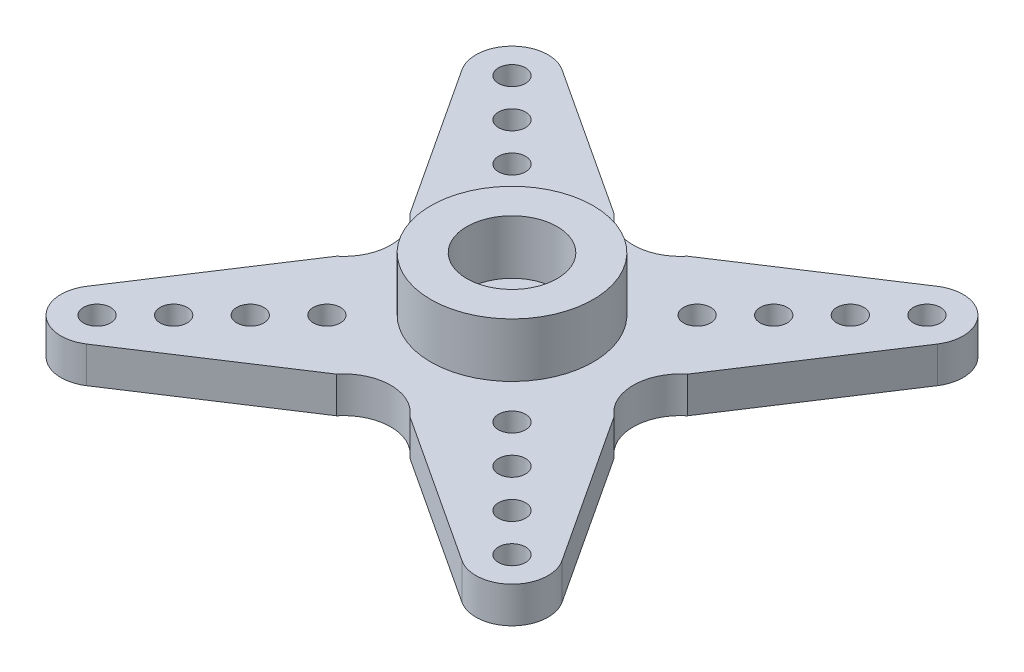
from build123d import *

# Parameters (mm, degrees)
BOSS_EXTRUDE1_DEPTH          = 2
SKETCH5_R                    = 4.5
SKETCH5_R_2                  = 2.5
BOSS_EXTRUDE2_DEPTH          = 3
SKETCH8_R                    = 1.5
CUT_EXTRUDE2_DEPTH           = 28.531284582
CUT_EXTRUDE3_REACH           = 29.531
SKETCH10_R                   = 0.75
LPATTERN1_COUNT              = 4
LPATTERN1_PITCH              = 3
CIRPATTERN1_COPY_1_REACH     = 29.531
CIRPATTERN1_COPY_1_SKETCH_R  = 0.75
CIRPATTERN1_COPY_2_REACH     = 29.531
CIRPATTERN1_COPY_2_SKETCH_R  = 0.75
CIRPATTERN1_COPY_3_REACH     = 29.531
CIRPATTERN1_COPY_3_SKETCH_R  = 0.75
CIRPATTERN1_COPY_4_REACH     = 29.531
CIRPATTERN1_COPY_4_SKETCH_R  = 0.75
CIRPATTERN1_COPY_5_REACH     = 29.531
CIRPATTERN1_COPY_5_SKETCH_R  = 0.75
CIRPATTERN1_COPY_6_REACH     = 29.531
CIRPATTERN1_COPY_6_SKETCH_R  = 0.75
CIRPATTERN1_COPY_7_REACH     = 29.531
CIRPATTERN1_COPY_7_SKETCH_R  = 0.75
CIRPATTERN1_COPY_8_REACH     = 29.531
CIRPATTERN1_COPY_8_SKETCH_R  = 0.75
CIRPATTERN1_COPY_9_REACH     = 29.531
CIRPATTERN1_COPY_9_SKETCH_R  = 0.75
CIRPATTERN1_COPY_10_REACH    = 29.531
CIRPATTERN1_COPY_10_SKETCH_R = 0.75
CIRPATTERN1_COPY_11_REACH    = 29.531
CIRPATTERN1_COPY_11_SKETCH_R = 0.75
CIRPATTERN1_COPY_12_REACH    = 29.531
CIRPATTERN1_COPY_12_SKETCH_R = 0.75
SKETCH9_R                    = 4.5
SKETCH9_R_2                  = 3.3
SKETCH9_R_3                  = 2.8
SKETCH9_R_4                  = 1.5
CUT_EXTRUDE4_DEPTH           = 1


with BuildPart() as part:
    # Sketch1 → Boss-Extrude1 (new body)
    with BuildSketch(Plane(origin=(0, 0, 0), x_dir=(1, 0, 0), z_dir=(0, 1, 0))):
        with BuildLine():
            Line((10.343686836, 2.276584719), (4.865650492, -6.089484718))
            ThreePointArc((4.865650492, -6.089484718), (3.897502175, -8.118293207), (4.865650492, -10.147101696))
            Line((4.865650492, -10.147101696), (10.343686836, -18.513171133))
            ThreePointArc((10.343686836, -18.513171133), (10.084686511, -21.022991964), (7.57486568, -21.281992289))
            Line((7.57486568, -21.281992289), (-0.791203757, -15.803955945))
            ThreePointArc((-0.791203757, -15.803955945), (-2.820012246, -14.835807628), (-4.848820735, -15.803955945))
            Line((-4.848820735, -15.803955945), (-13.214890172, -21.281992289))
            ThreePointArc((-13.214890172, -21.281992289), (-15.724711003, -21.022991964), (-15.983711328, -18.513171133))
            Line((-15.983711328, -18.513171133), (-10.505674984, -10.147101696))
            ThreePointArc((-10.505674984, -10.147101696), (-9.537526667, -8.118293207), (-10.505674984, -6.089484718))
            Line((-10.505674984, -6.089484718), (-15.983711328, 2.276584719))
            ThreePointArc((-15.983711328, 2.276584719), (-15.724711003, 4.78640555), (-13.214890172, 5.045405875))
            Line((-13.214890172, 5.045405875), (-4.848820735, -0.432630469))
            ThreePointArc((-4.848820735, -0.432630469), (-2.820012246, -1.400778786), (-0.791203757, -0.432630469))
            Line((-0.791203757, -0.432630469), (7.57486568, 5.045405875))
            ThreePointArc((7.57486568, 5.045405875), (10.084686511, 4.78640555), (10.343686836, 2.276584719))
        make_face()
    extrude(amount=BOSS_EXTRUDE1_DEPTH)

    # Sketch5 → Boss-Extrude2 (add)
    with BuildSketch(Plane(origin=(0, 2, 0), x_dir=(1, 0, 0), z_dir=(0, 1, 0))):
        with Locations((-2.820012246, -8.118293207)):
            Circle(SKETCH5_R)
        with Locations((-2.820012246, -8.118293207)):
            Circle(SKETCH5_R_2, mode=Mode.SUBTRACT)
    extrude(amount=BOSS_EXTRUDE2_DEPTH)

    # Sketch8 → Cut-Extrude2 (cut, through all)
    with BuildSketch(Plane.XZ):
        with Locations((-2.820012246, 8.118293207)):
            Circle(SKETCH8_R)
    extrude(amount=-CUT_EXTRUDE2_DEPTH, mode=Mode.SUBTRACT)

    # Sketch10 → Cut-Extrude3 (cut, up to next)
    with BuildSketch(Plane.XZ, mode=Mode.PRIVATE) as cut_extrude3_sk1:
        with Locations((8.670472948, -3.372191987)):
            Circle(SKETCH10_R)
    cut_extrude3_tool1 = extrude(cut_extrude3_sk1.sketch, amount=-CUT_EXTRUDE3_REACH, mode=Mode.PRIVATE) & part.part
    cut_extrude3 = cut_extrude3_tool1.solids().sort_by_distance((8.670473, 0, -3.372192))[0]
    add(cut_extrude3, mode=Mode.SUBTRACT)

    # LPattern1: Cut-Extrude3 ×4
    with Locations(*[Vector(-0.7071067811865462, 0, 0.7071067811865488) * (i * LPATTERN1_PITCH) for i in range(1, LPATTERN1_COUNT)]):
        add(cut_extrude3, mode=Mode.SUBTRACT)

    # CirPattern1 copy 1 sketch → CirPattern1 copy 1 (cut, up to next)
    with BuildSketch(Plane(origin=(3.176960618, 0, 8.81698511), x_dir=(0, 0, 1), z_dir=(0, -1, 0)), mode=Mode.PRIVATE) as cirpattern1_copy_1_sk1:
        with Locations((8.670472948, -3.372191987)):
            Circle(CIRPATTERN1_COPY_1_SKETCH_R)
    cirpattern1_copy_1_tool1 = extrude(cirpattern1_copy_1_sk1.sketch, amount=-CIRPATTERN1_COPY_1_REACH, mode=Mode.PRIVATE) & part.part
    add(cirpattern1_copy_1_tool1.solids().sort_by_distance((6.549152618, 0, 17.48745811))[0], mode=Mode.SUBTRACT)

    # CirPattern1 copy 2 sketch → CirPattern1 copy 2 (cut, up to next)
    with BuildSketch(Plane(origin=(-3.518704148, 0, 14.115266071), x_dir=(-1, 0, 0), z_dir=(0, -1, 0)), mode=Mode.PRIVATE) as cirpattern1_copy_2_sk1:
        with Locations((8.670472948, -3.372191987)):
            Circle(CIRPATTERN1_COPY_2_SKETCH_R)
    cirpattern1_copy_2_tool1 = extrude(cirpattern1_copy_2_sk1.sketch, amount=-CIRPATTERN1_COPY_2_REACH, mode=Mode.PRIVATE) & part.part
    add(cirpattern1_copy_2_tool1.solids().sort_by_distance((-12.189177148, 0, 17.487458071))[0], mode=Mode.SUBTRACT)

    # CirPattern1 copy 3 sketch → CirPattern1 copy 3 (cut, up to next)
    with BuildSketch(Plane(origin=(-8.81698511, 0, 7.419601305), x_dir=(0, 0, -1), z_dir=(0, -1, 0)), mode=Mode.PRIVATE) as cirpattern1_copy_3_sk1:
        with Locations((8.670472948, -3.372191987)):
            Circle(CIRPATTERN1_COPY_3_SKETCH_R)
    cirpattern1_copy_3_tool1 = extrude(cirpattern1_copy_3_sk1.sketch, amount=-CIRPATTERN1_COPY_3_REACH, mode=Mode.PRIVATE) & part.part
    add(cirpattern1_copy_3_tool1.solids().sort_by_distance((-12.18917711, 0, -1.250871695))[0], mode=Mode.SUBTRACT)

    # CirPattern1 copy 4 sketch → CirPattern1 copy 4 (cut, up to next)
    with BuildSketch(Plane(origin=(1.055640274, 0, 6.695664766), x_dir=(0, 0, 1), z_dir=(0, -1, 0)), mode=Mode.PRIVATE) as cirpattern1_copy_4_sk1:
        with Locations((8.670472948, -3.372191987)):
            Circle(CIRPATTERN1_COPY_4_SKETCH_R)
    cirpattern1_copy_4_tool1 = extrude(cirpattern1_copy_4_sk1.sketch, amount=-CIRPATTERN1_COPY_4_REACH, mode=Mode.PRIVATE) & part.part
    add(cirpattern1_copy_4_tool1.solids().sort_by_distance((4.427832274, 0, 15.366137766))[0], mode=Mode.SUBTRACT)

    # CirPattern1 copy 5 sketch → CirPattern1 copy 5 (cut, up to next)
    with BuildSketch(Plane(origin=(-1.397383805, 0, 11.993945727), x_dir=(-1, 0, 0), z_dir=(0, -1, 0)), mode=Mode.PRIVATE) as cirpattern1_copy_5_sk1:
        with Locations((8.670472948, -3.372191987)):
            Circle(CIRPATTERN1_COPY_5_SKETCH_R)
    cirpattern1_copy_5_tool1 = extrude(cirpattern1_copy_5_sk1.sketch, amount=-CIRPATTERN1_COPY_5_REACH, mode=Mode.PRIVATE) & part.part
    add(cirpattern1_copy_5_tool1.solids().sort_by_distance((-10.067856805, 0, 15.366137727))[0], mode=Mode.SUBTRACT)

    # CirPattern1 copy 6 sketch → CirPattern1 copy 6 (cut, up to next)
    with BuildSketch(Plane(origin=(-6.695664766, 0, 9.540921648), x_dir=(0, 0, -1), z_dir=(0, -1, 0)), mode=Mode.PRIVATE) as cirpattern1_copy_6_sk1:
        with Locations((8.670472948, -3.372191987)):
            Circle(CIRPATTERN1_COPY_6_SKETCH_R)
    cirpattern1_copy_6_tool1 = extrude(cirpattern1_copy_6_sk1.sketch, amount=-CIRPATTERN1_COPY_6_REACH, mode=Mode.PRIVATE) & part.part
    add(cirpattern1_copy_6_tool1.solids().sort_by_distance((-10.067856766, 0, 0.870448648))[0], mode=Mode.SUBTRACT)

    # CirPattern1 copy 7 sketch → CirPattern1 copy 7 (cut, up to next)
    with BuildSketch(Plane(origin=(-1.06568007, 0, 4.574344422), x_dir=(0, 0, 1), z_dir=(0, -1, 0)), mode=Mode.PRIVATE) as cirpattern1_copy_7_sk1:
        with Locations((8.670472948, -3.372191987)):
            Circle(CIRPATTERN1_COPY_7_SKETCH_R)
    cirpattern1_copy_7_tool1 = extrude(cirpattern1_copy_7_sk1.sketch, amount=-CIRPATTERN1_COPY_7_REACH, mode=Mode.PRIVATE) & part.part
    add(cirpattern1_copy_7_tool1.solids().sort_by_distance((2.30651193, 0, 13.244817422))[0], mode=Mode.SUBTRACT)

    # CirPattern1 copy 8 sketch → CirPattern1 copy 8 (cut, up to next)
    with BuildSketch(Plane(origin=(0.723936539, 0, 9.872625384), x_dir=(-1, 0, 0), z_dir=(0, -1, 0)), mode=Mode.PRIVATE) as cirpattern1_copy_8_sk1:
        with Locations((8.670472948, -3.372191987)):
            Circle(CIRPATTERN1_COPY_8_SKETCH_R)
    cirpattern1_copy_8_tool1 = extrude(cirpattern1_copy_8_sk1.sketch, amount=-CIRPATTERN1_COPY_8_REACH, mode=Mode.PRIVATE) & part.part
    add(cirpattern1_copy_8_tool1.solids().sort_by_distance((-7.946536461, 0, 13.244817384))[0], mode=Mode.SUBTRACT)

    # CirPattern1 copy 9 sketch → CirPattern1 copy 9 (cut, up to next)
    with BuildSketch(Plane(origin=(-4.574344422, 0, 11.662241992), x_dir=(0, 0, -1), z_dir=(0, -1, 0)), mode=Mode.PRIVATE) as cirpattern1_copy_9_sk1:
        with Locations((8.670472948, -3.372191987)):
            Circle(CIRPATTERN1_COPY_9_SKETCH_R)
    cirpattern1_copy_9_tool1 = extrude(cirpattern1_copy_9_sk1.sketch, amount=-CIRPATTERN1_COPY_9_REACH, mode=Mode.PRIVATE) & part.part
    add(cirpattern1_copy_9_tool1.solids().sort_by_distance((-7.946536422, 0, 2.991768992))[0], mode=Mode.SUBTRACT)

    # CirPattern1 copy 10 sketch → CirPattern1 copy 10 (cut, up to next)
    with BuildSketch(Plane(origin=(5.298280961, 0, 10.938305453), x_dir=(0, 0, 1), z_dir=(0, -1, 0)), mode=Mode.PRIVATE) as cirpattern1_copy_10_sk1:
        with Locations((8.670472948, -3.372191987)):
            Circle(CIRPATTERN1_COPY_10_SKETCH_R)
    cirpattern1_copy_10_tool1 = extrude(cirpattern1_copy_10_sk1.sketch, amount=-CIRPATTERN1_COPY_10_REACH, mode=Mode.PRIVATE) & part.part
    add(cirpattern1_copy_10_tool1.solids().sort_by_distance((8.670472961, 0, 19.608778453))[0], mode=Mode.SUBTRACT)

    # CirPattern1 copy 11 sketch → CirPattern1 copy 11 (cut, up to next)
    with BuildSketch(Plane(origin=(-5.640024492, 0, 16.236586414), x_dir=(-1, 0, 0), z_dir=(0, -1, 0)), mode=Mode.PRIVATE) as cirpattern1_copy_11_sk1:
        with Locations((8.670472948, -3.372191987)):
            Circle(CIRPATTERN1_COPY_11_SKETCH_R)
    cirpattern1_copy_11_tool1 = extrude(cirpattern1_copy_11_sk1.sketch, amount=-CIRPATTERN1_COPY_11_REACH, mode=Mode.PRIVATE) & part.part
    add(cirpattern1_copy_11_tool1.solids().sort_by_distance((-14.310497492, 0, 19.608778414))[0], mode=Mode.SUBTRACT)

    # CirPattern1 copy 12 sketch → CirPattern1 copy 12 (cut, up to next)
    with BuildSketch(Plane(origin=(-10.938305453, 0, 5.298280961), x_dir=(0, 0, -1), z_dir=(0, -1, 0)), mode=Mode.PRIVATE) as cirpattern1_copy_12_sk1:
        with Locations((8.670472948, -3.372191987)):
            Circle(CIRPATTERN1_COPY_12_SKETCH_R)
    cirpattern1_copy_12_tool1 = extrude(cirpattern1_copy_12_sk1.sketch, amount=-CIRPATTERN1_COPY_12_REACH, mode=Mode.PRIVATE) & part.part
    add(cirpattern1_copy_12_tool1.solids().sort_by_distance((-14.310497453, 0, -3.372192039))[0], mode=Mode.SUBTRACT)

    # Sketch9 → Cut-Extrude4 (cut)
    # profile 1 of 2: a face of its own
    with BuildSketch(Plane.XZ):
        with Locations((-2.820012246, 8.118293207)):
            Circle(SKETCH9_R)
        with Locations((-2.820012246, 8.118293207)):
            Circle(SKETCH9_R_2, mode=Mode.SUBTRACT)
    # profile 2 of 2: a face of its own
    with BuildSketch(Plane.XZ):
        with Locations((-2.820012246, 8.118293207)):
            Circle(SKETCH9_R_3)
        with Locations((-2.820012246, 8.118293207)):
            Circle(SKETCH9_R_4, mode=Mode.SUBTRACT)
    extrude(amount=-CUT_EXTRUDE4_DEPTH, mode=Mode.SUBTRACT)


solid = part.part
